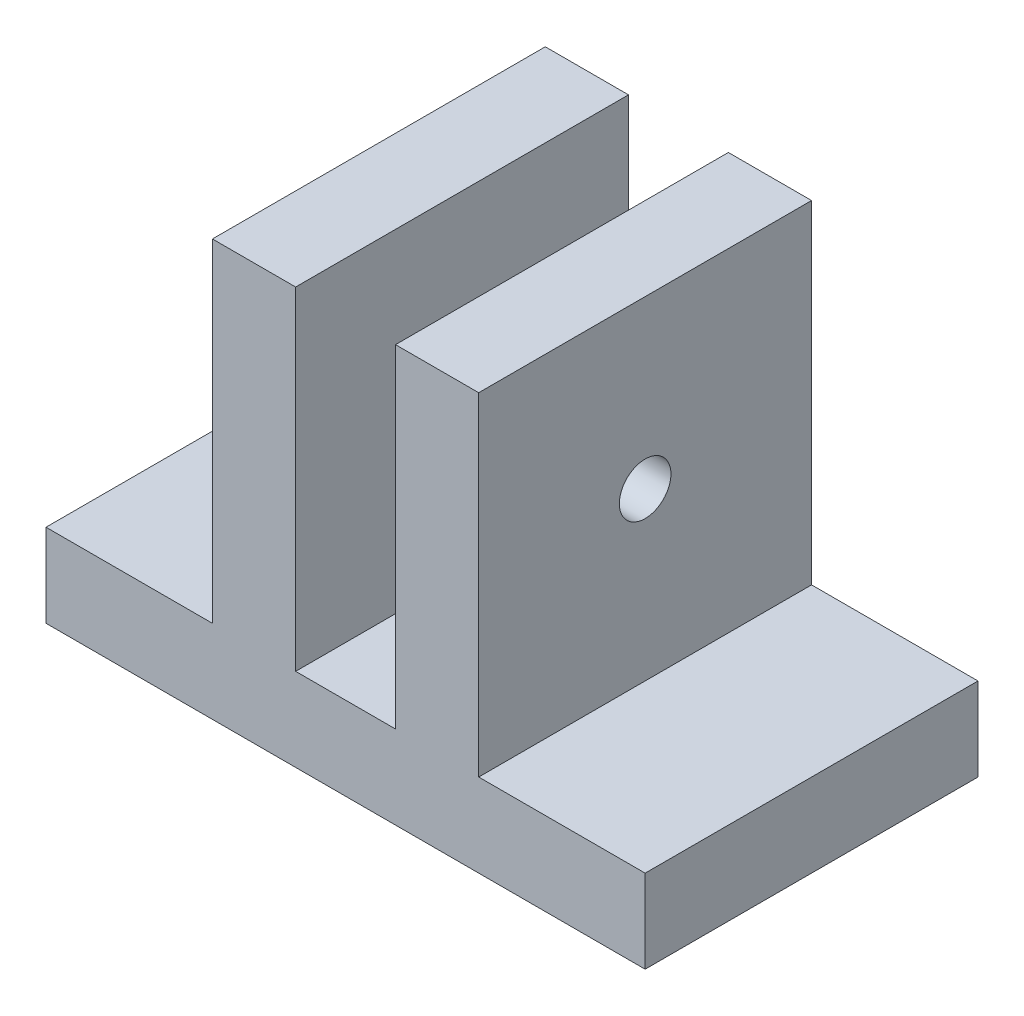
from build123d import *

# Parameters (mm, degrees)
BOSS_EXTRUDE1_DEPTH     = 10
CUT_EXTRUDE1_DEPTH      = 29.705400189
CUT_EXTRUDE1_DEPTH_BACK = 29.705400189
SKETCH2_R               = 1.55


with BuildPart() as part:
    # Sketch1 → Boss-Extrude1 (new, symmetric)
    with BuildSketch(Plane.XY):
        Polygon((-3, 20), (-3, 0), (3, 0), (3, 20), (8, 20), (8, 0), (18, 0), (18, -5), (-18, -5), (-18, 0), (-8, 0), (-8, 20), align=None)
    extrude(amount=BOSS_EXTRUDE1_DEPTH, both=True)

    # Sketch2 → Cut-Extrude1 (cut, two sides: drawn at the far end of the back side and taken through both)
    with BuildSketch(Plane(origin=(0, 0, 0), x_dir=(0, 0, -1), z_dir=(1, 0, 0)).offset(-CUT_EXTRUDE1_DEPTH_BACK)):
        with Locations(Location((0, 10, 0), (0, 0, 270))):
            Circle(SKETCH2_R)
    extrude(amount=CUT_EXTRUDE1_DEPTH + CUT_EXTRUDE1_DEPTH_BACK, mode=Mode.SUBTRACT)


solid = part.part
